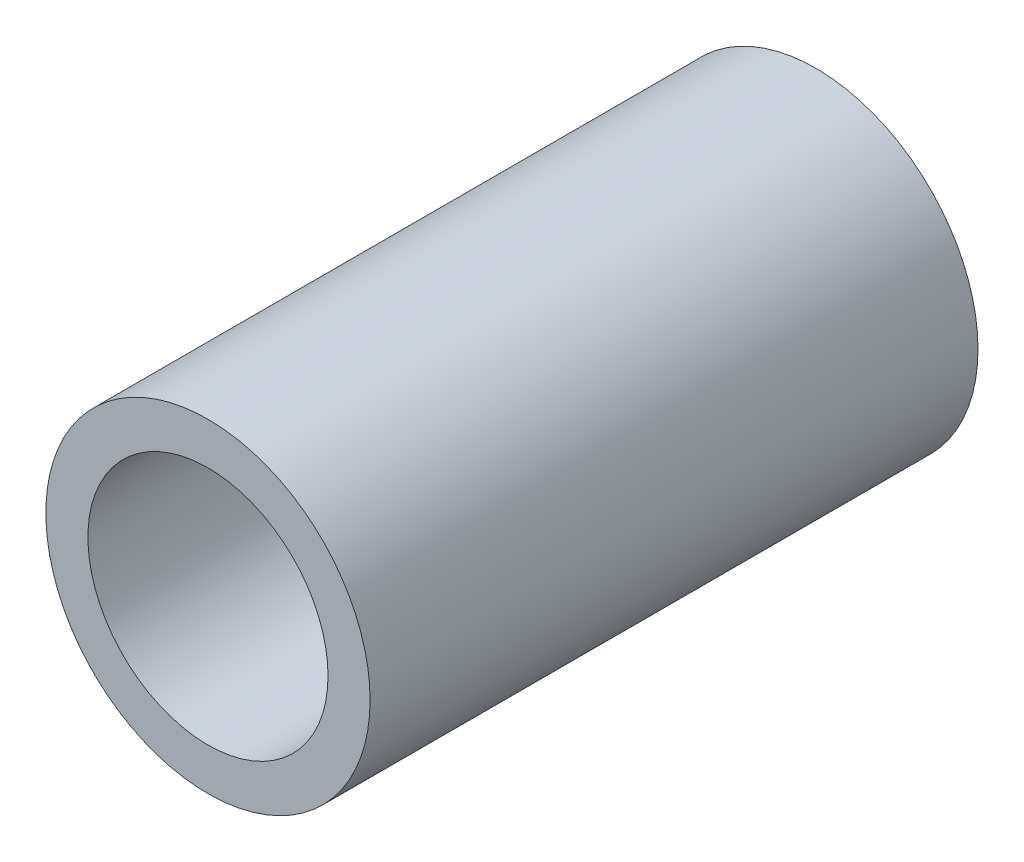
from build123d import *

# Parameters (mm, degrees)
SKETCH1_R           = 10.668
SKETCH1_R_2         = 7.8994
EXTRUDE_THIN1_DEPTH = 20


with BuildPart() as part:
    # Sketch1 → Extrude-Thin1 (new, symmetric)
    with BuildSketch(Plane.XY):
        Circle(SKETCH1_R)
        Circle(SKETCH1_R_2, mode=Mode.SUBTRACT)
    extrude(amount=EXTRUDE_THIN1_DEPTH, both=True)


solid = part.part
